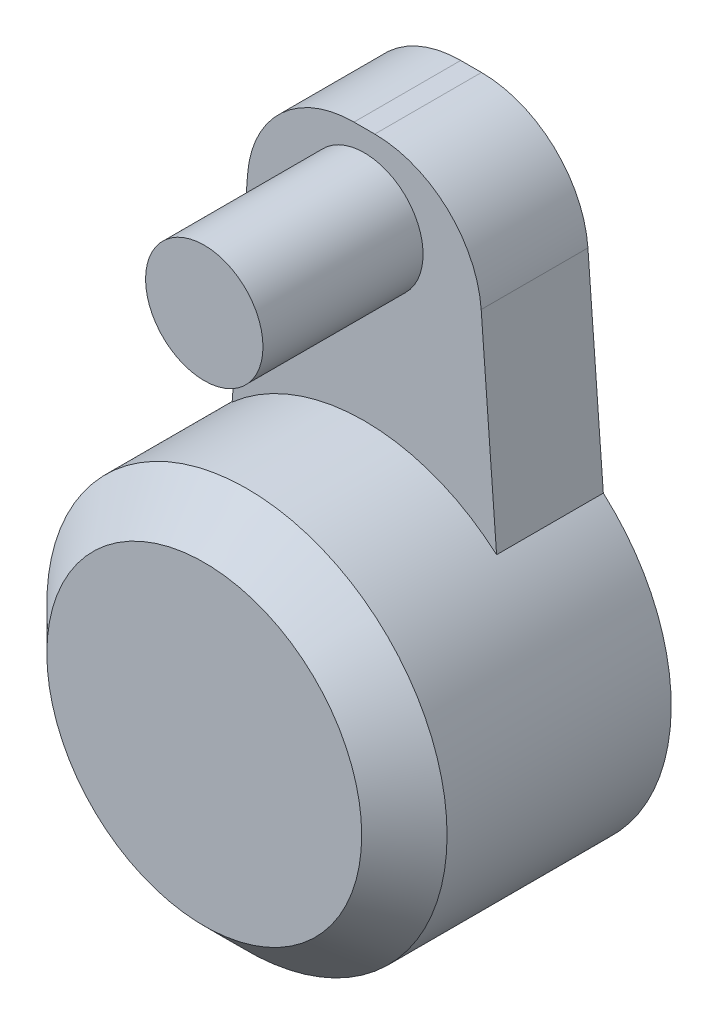
from build123d import *

# Parameters (mm, degrees)
EXTRUDE_1_DEPTH     = 2
SKETCH_2_R          = 1.1
EXTRUDE_2_DEPTH     = 3
SKETCH_3_R          = 3.75
EXTRUDE_3_DEPTH     = 5
CHAMFER_1_SIZE      = 0.8
SKETCH_4_R          = 1.1
CUT_EXTRUDE_1_DEPTH = 4
SKETCH_5_R          = 2.25
CUT_EXTRUDE_2_DEPTH = 1.5


with BuildPart() as part:
    # 草图1 → 凸台-拉伸1 (new body)
    with BuildSketch(Plane.XY):
        with BuildLine():
            Line((-2.189141888, -0.35), (-2.65, -6.47746827))
            Line((-2.65, -6.47746827), (2.65, -6.47746827))
            Line((2.65, -6.47746827), (2.189141888, -0.35))
            ThreePointArc((2.189141888, -0.35), (1.554921872, 0.96628783), (0.194774821, 1.5))
            Line((0.194774821, 1.5), (-0.194774821, 1.5))
            ThreePointArc((-0.194774821, 1.5), (-1.554921872, 0.96628783), (-2.189141888, -0.35))
        make_face()
    extrude(amount=EXTRUDE_1_DEPTH)

    # 草图2 → 凸台-拉伸2 (add)
    with BuildSketch(Plane.XY.offset(2)):
        with Locations(Location((0, 0, 0), (0, 0, 180))):
            Circle(SKETCH_2_R)
    extrude(amount=EXTRUDE_2_DEPTH)

    # 草图3 → 凸台-拉伸3 (add)
    with BuildSketch(Plane.XY):
        with Locations(Location((0, -7, 0), (0, 0, 131.352385807))):
            Circle(SKETCH_3_R)
    extrude(amount=EXTRUDE_3_DEPTH)

    # 倒角1
    chamfer_1_edges = [part.edges().sort_by_distance(p)[0] for p in [
        (2.477581037, -9.814976413, 5),
    ]]
    chamfer(chamfer_1_edges, length=CHAMFER_1_SIZE)

    # 草图4 → 切除-拉伸1 (cut)
    with BuildSketch(Plane(origin=(0, 0, 0), x_dir=(-1, 0, 0), z_dir=(0, 0, -1))):
        with Locations((0, -7)):
            Circle(SKETCH_4_R)
    extrude(amount=-CUT_EXTRUDE_1_DEPTH, mode=Mode.SUBTRACT)

    # 草图5 → 切除-拉伸2 (cut)
    with BuildSketch(Plane(origin=(0, 0, 0), x_dir=(-1, 0, 0), z_dir=(0, 0, -1))):
        with Locations((0, -7)):
            Circle(SKETCH_5_R)
    extrude(amount=-CUT_EXTRUDE_2_DEPTH, mode=Mode.SUBTRACT)


solid = part.part
